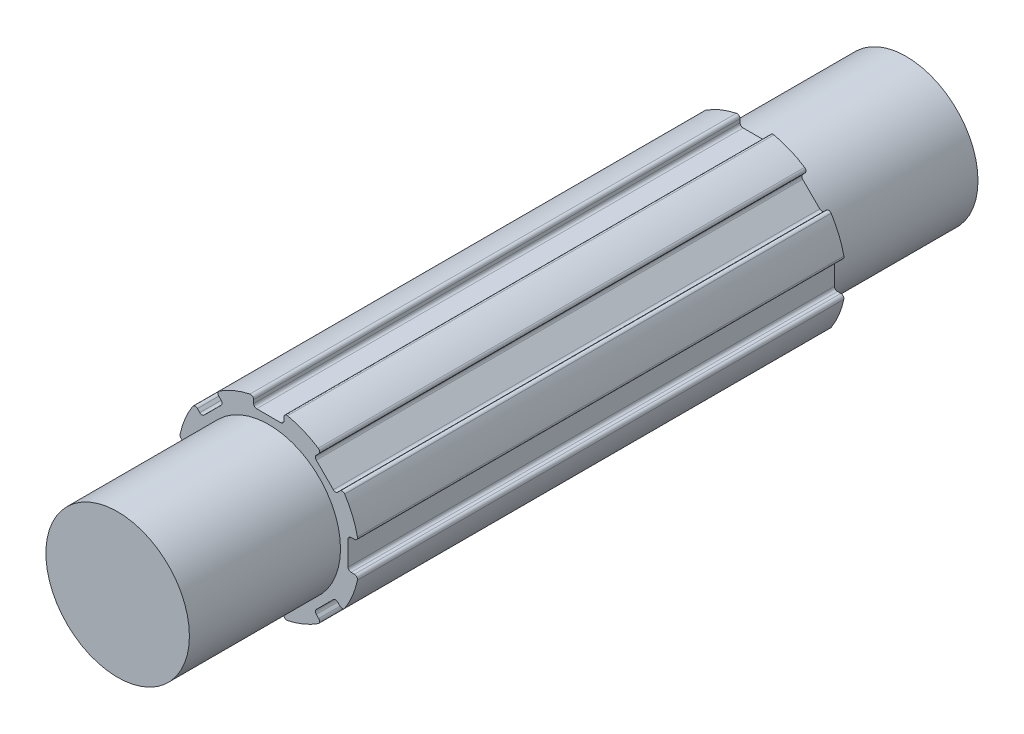
from build123d import *

# Parameters (mm, degrees)
SKETCH1_R                = 6
BOSS_EXTRUDE1_DEPTH      = 26.095
SKETCH2_OUTSIDE_W        = 24.976
SKETCH2_OUTSIDE_H        = 24.976
SKETCH2_OUTSIDE_R        = 4.75
CUT_EXTRUDE1_DEPTH       = 10
SKETCH3_W                = 2
SKETCH3_H                = 2
CUT_EXTRUDE2_DEPTH       = 28.439916636
FILLET1_R                = 0.2
CIRPATTERN1_COUNT        = 8
FILLET1_OF_CIRPATTERN1_R = 0.2


with BuildPart() as part:
    # Sketch1 → Boss-Extrude1 (new, symmetric)
    with BuildSketch(Plane.XY):
        Circle(SKETCH1_R)
    extrude(amount=BOSS_EXTRUDE1_DEPTH, both=True)

    # Sketch2 outside → Cut-Extrude1 (cut)
    with BuildSketch(Plane.XY.offset(26.095)):
        Rectangle(SKETCH2_OUTSIDE_W, SKETCH2_OUTSIDE_H)
        Circle(SKETCH2_OUTSIDE_R, mode=Mode.SUBTRACT)
    cut_extrude1 = extrude(amount=-CUT_EXTRUDE1_DEPTH, mode=Mode.SUBTRACT)

    # Mirror1: Cut-Extrude1 across plane
    add(cut_extrude1.mirror(Plane.XY), mode=Mode.SUBTRACT)

    # Sketch3 → Cut-Extrude2 (cut, symmetric)
    with BuildSketch(Plane.XY):
        with Locations((0, 6.25)):
            Rectangle(SKETCH3_W, SKETCH3_H)
    cut_extrude2 = extrude(amount=CUT_EXTRUDE2_DEPTH, both=True, mode=Mode.SUBTRACT)

    # Fillet1
    fillet1_edges = [part.edges().sort_by_distance(p)[0] for p in [
        (1, 5.916079783, 0),
        (1, 5.25, 0),
        (-1, 5.916079783, 0),
        (-1, 5.25, 0),
    ]]
    fillet(fillet1_edges, radius=FILLET1_R)

    # CirPattern1: Cut-Extrude2 ×8 about axis
    cirpattern1_axis = Axis((0, 0, 0), (0, 0, 1))
    for i in range(1, CIRPATTERN1_COUNT):
        add(cut_extrude2.rotate(cirpattern1_axis, i * 360 / CIRPATTERN1_COUNT), mode=Mode.SUBTRACT)

    # Fillet1 of CirPattern1
    fillet1_of_cirpattern1_edges = [part.edges().sort_by_distance(p)[0] for p in [
        (-3.476193351, 4.890406914, 0),
        (-3.00520382, 4.419417382, 0),
        (-4.890406914, 3.476193351, 0),
        (-4.419417382, 3.00520382, 0),
        (-5.916079783, 1, 0),
        (-5.25, 1, 0),
        (-5.916079783, -1, 0),
        (-5.25, -1, 0),
        (-4.890406914, -3.476193351, 0),
        (-4.419417382, -3.00520382, 0),
        (-3.476193351, -4.890406914, 0),
        (-3.00520382, -4.419417382, 0),
        (-1, -5.916079783, 0),
        (-1, -5.25, 0),
        (1, -5.916079783, 0),
        (1, -5.25, 0),
        (3.476193351, -4.890406914, 0),
        (3.00520382, -4.419417382, 0),
        (4.890406914, -3.476193351, 0),
        (4.419417382, -3.00520382, 0),
        (5.916079783, -1, 0),
        (5.25, -1, 0),
        (5.916079783, 1, 0),
        (5.25, 1, 0),
        (4.890406914, 3.476193351, 0),
        (4.419417382, 3.00520382, 0),
        (3.476193351, 4.890406914, 0),
        (3.00520382, 4.419417382, 0),
    ]]
    fillet(fillet1_of_cirpattern1_edges, radius=FILLET1_OF_CIRPATTERN1_R)


solid = part.part
